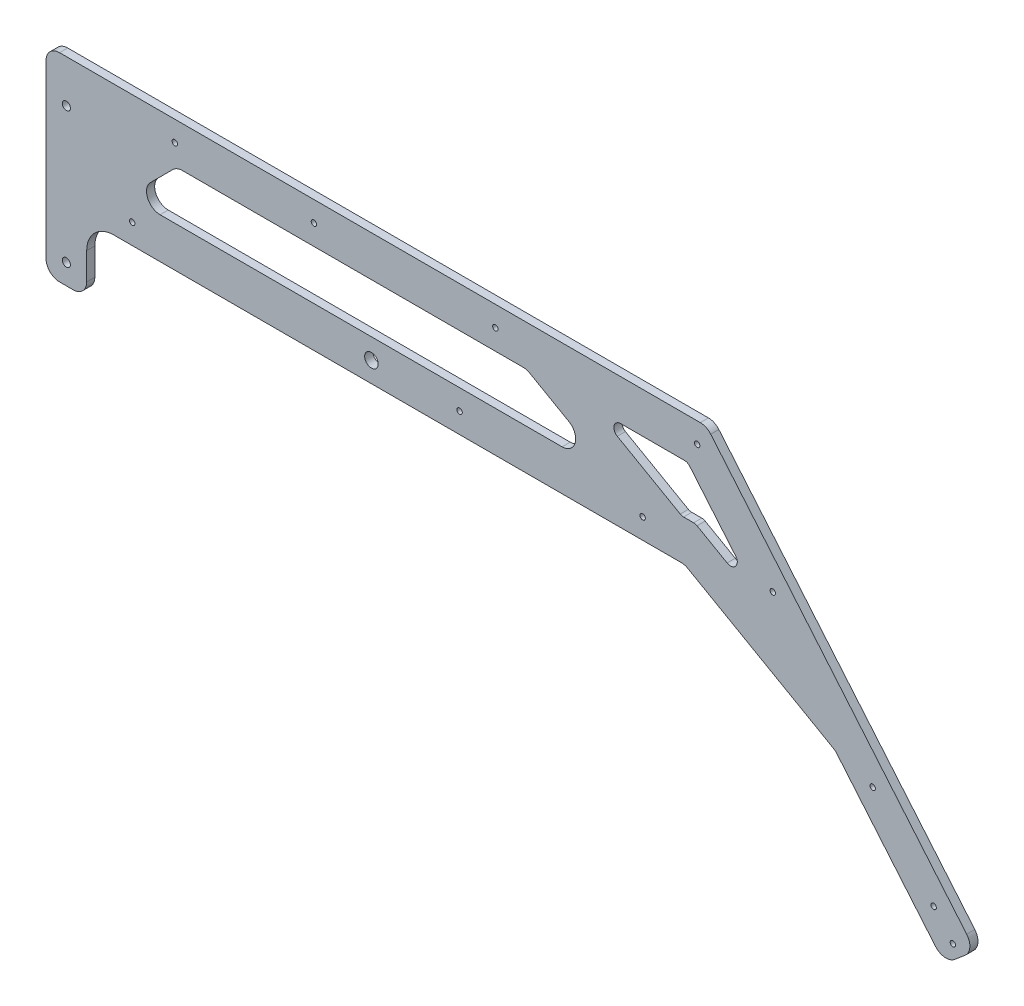
from build123d import *

# Parameters (mm, degrees)
SKETCH1_R           = 2
SKETCH1_R_2         = 3
SKETCH1_R_3         = 5
BOSS_EXTRUDE1_DEPTH = 6
FILLET1_R           = 20
FILLET2_R           = 10
CUT_EXTRUDE1_DEPTH  = 697.921769691
FILLET3_R           = 5
SKETCH3_R           = 2
CUT_EXTRUDE2_DEPTH  = 697.921769691
SKETCH9_R           = 2
CUT_EXTRUDE4_DEPTH  = 697.921769691


with BuildPart() as part:
    # Sketch1 → Boss-Extrude1 (new body)
    # profile 1 of 2: a face of its own
    with BuildSketch(Plane.XY):
        Polygon((0, 146.44), (0, 0), (30, 0), (30, 50), (60, 80), (96.44, 116.44), (354.44, 116.44), (418.384389798, 80), (471.027959885, 50), (582.094928321, -13.293751689), (662.443379532, -109.049307079), (685.424712826, -89.765678789), (487.224614872, 146.44), align=None)
        with Locations((668.791745302, -93.279137389)):
            Circle(SKETCH1_R, mode=Mode.SUBTRACT)
        with Locations((654.650417888, -76.42615964)):
            Circle(SKETCH1_R, mode=Mode.SUBTRACT)
        with Locations((15, 15)):
            Circle(SKETCH1_R_2, mode=Mode.SUBTRACT)
        with Locations((15, 115)):
            Circle(SKETCH1_R_2, mode=Mode.SUBTRACT)
    # profile 2 of 2: a face of its own
    with BuildSketch(Plane.XY):
        Polygon((60, 80), (30, 50), (471.027959885, 50), (418.384389798, 80), align=None)
        with Locations((240.003736421, 65)):
            Circle(SKETCH1_R_3, mode=Mode.SUBTRACT)
    extrude(amount=BOSS_EXTRUDE1_DEPTH)

    # Fillet1
    fillet1_edges = [part.edges().sort_by_distance(p)[0] for p in [
        (30, 50, 3),
    ]]
    fillet(fillet1_edges, radius=FILLET1_R)

    # Fillet2
    fillet2_edges = [part.edges().sort_by_distance(p)[0] for p in [
        (418.384389798, 80, 3),
        (354.44, 116.44, 3),
        (96.44, 116.44, 3),
        (60, 80, 3),
        (30, 0, 3),
        (0, 0, 3),
        (0, 146.44, 3),
        (487.224614872, 146.44, 3),
        (685.424712826, -89.765678789, 3),
        (662.443379532, -109.049307079, 3),
        (582.094928321, -13.293751689, 3),
        (471.027959885, 50, 3),
    ]]
    fillet(fillet2_edges, radius=FILLET2_R)

    # Sketch2 → Cut-Extrude1 (cut, through all)
    with BuildSketch(Plane.XY.offset(6)):
        Polygon((404.933023937, 116.44), (473.235385128, 116.44), (526.571079334, 52.876994817), (478.976018523, 80), (468.877413735, 80), align=None)
    extrude(amount=-CUT_EXTRUDE1_DEPTH, mode=Mode.SUBTRACT)

    # Fillet3
    fillet3_edges = [part.edges().sort_by_distance(p)[0] for p in [
        (468.877413735, 80, 3),
        (404.933023937, 116.44, 3),
        (473.235385128, 116.44, 3),
        (526.571079334, 52.876994817, 3),
        (478.976018523, 80, 3),
    ]]
    fillet(fillet3_edges, radius=FILLET3_R)

    # Sketch3 → Cut-Extrude2 (cut, through all)
    with BuildSketch(Plane.XY.offset(6)):
        with Locations((609.65528521, -22.803048622)):
            Circle(SKETCH3_R)
        with Locations((440.003736421, 65)):
            Circle(SKETCH3_R)
        with Locations((535.979779495, 65)):
            Circle(SKETCH3_R)
        with Locations((480.23, 131.44)):
            Circle(SKETCH3_R)
        with Locations((305.003736421, 65)):
            Circle(SKETCH3_R)
        with Locations((331.395769145, 131.44)):
            Circle(SKETCH3_R)
        with Locations((197.561538291, 131.44)):
            Circle(SKETCH3_R)
    extrude(amount=-CUT_EXTRUDE2_DEPTH, mode=Mode.SUBTRACT)

    # Sketch9 → Cut-Extrude4 (cut, through all)
    with BuildSketch(Plane.XY.offset(6)):
        with Locations((95, 131.44)):
            Circle(SKETCH9_R)
        with Locations((63.56, 65)):
            Circle(SKETCH9_R)
    extrude(amount=-CUT_EXTRUDE4_DEPTH, mode=Mode.SUBTRACT)


solid = part.part
